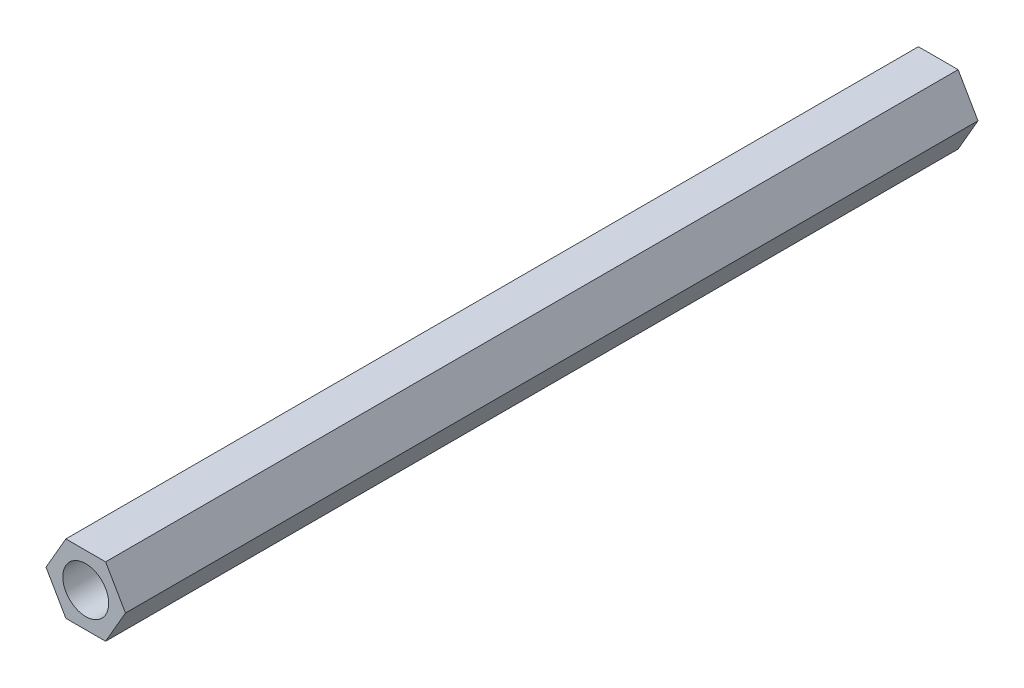
from build123d import *

# Parameters (mm, degrees)
SKETCH_1_R      = 3
EXTRUDE_1_DEPTH = 111.5


with BuildPart() as part:
    # 草图1 → 凸台-拉伸1 (new body)
    with BuildSketch(Plane.XY):
        Polygon((5.196152423, 0), (2.598076211, 4.5), (-2.598076211, 4.5), (-5.196152423, 0), (-2.598076211, -4.5), (2.598076211, -4.5), align=None)
        with Locations(Location((0, 0, 0), (0, 0, 180))):
            Circle(SKETCH_1_R, mode=Mode.SUBTRACT)
    extrude(amount=EXTRUDE_1_DEPTH)


solid = part.part
